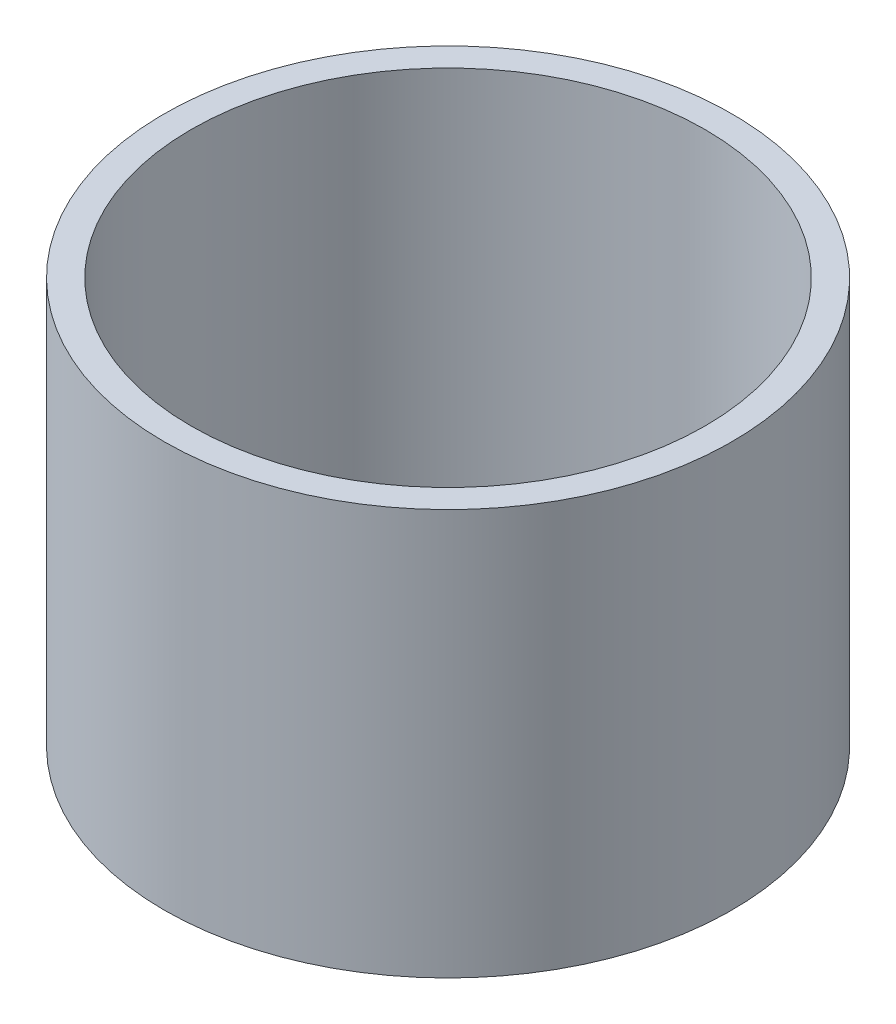
from build123d import *

# Parameters (mm, degrees)
SKETCH1_R           = 1.05
SKETCH1_R_2         = 0.95
BOSS_EXTRUDE1_DEPTH = 1.5


with BuildPart() as part:
    # Sketch1 → Boss-Extrude1 (new body)
    with BuildSketch(Plane(origin=(0, 0, 0), x_dir=(1, 0, 0), z_dir=(0, 1, 0))):
        with Locations(Location((0, 0, 0), (0, 0, 270))):
            Circle(SKETCH1_R)
        with Locations(Location((0, 0, 0), (0, 0, 270))):
            Circle(SKETCH1_R_2, mode=Mode.SUBTRACT)
    extrude(amount=BOSS_EXTRUDE1_DEPTH)


solid = part.part
